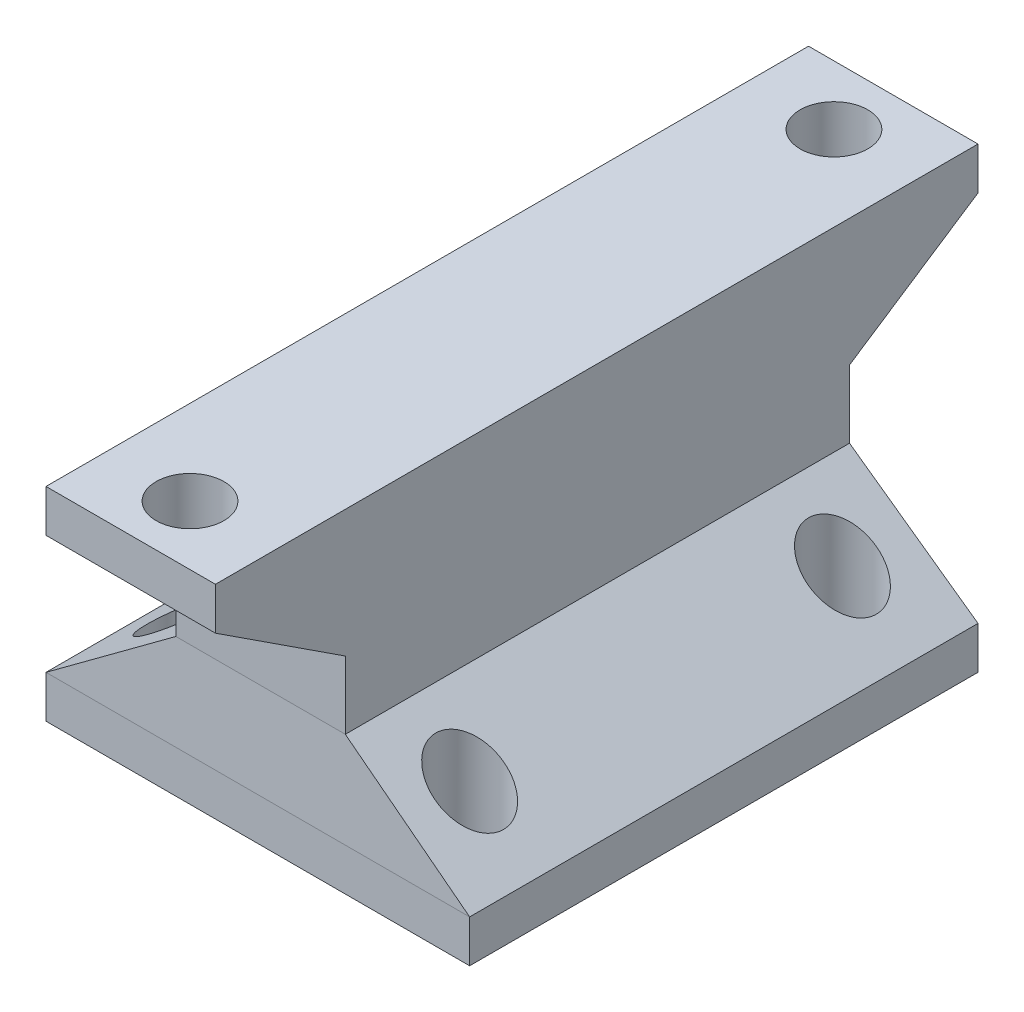
from build123d import *

# Parameters (mm, degrees)
SKETCH1_W               = 20
SKETCH1_H               = 90
BOSS_EXTRUDE1_DEPTH     = 5
BOSS_EXTRUDE2_DEPTH     = 20
SKETCH3_W               = 50
SKETCH3_H               = 60
BOSS_EXTRUDE3_DEPTH     = 5
SKETCH6_W               = 20
SKETCH6_H               = 59.508572424
BOSS_EXTRUDE4_DEPTH     = 8
CUT_EXTRUDE3_DEPTH      = 10
CUT_EXTRUDE3_DEPTH_BACK = 20
SKETCH5_R               = 4
CUT_EXTRUDE4_DEPTH      = 20
SKETCH7_R               = 5
CUT_EXTRUDE5_DEPTH      = 2


with BuildPart() as part:
    # Sketch1 → Boss-Extrude1 (new body)
    with BuildSketch(Plane(origin=(0, 0, 0), x_dir=(1, 0, 0), z_dir=(0, 1, 0))):
        Rectangle(SKETCH1_W, SKETCH1_H)
    extrude(amount=BOSS_EXTRUDE1_DEPTH)

    # Sketch2 → Boss-Extrude2 (add)
    with BuildSketch(Plane(origin=(10, 0, 0), x_dir=(0, 0, -1), z_dir=(1, 0, 0))):
        Polygon((-45, 0), (-29.672384363, -9.999664599), (0.081901849, -9.999664599), (0, 0), align=None)
        Polygon((0, 0), (0.081901849, -9.999664599), (29.836188061, -9.999664599), (45, 0), align=None)
    extrude(amount=-BOSS_EXTRUDE2_DEPTH)

    # Sketch6 → Boss-Extrude4 (add)
    with BuildSketch(Plane.XZ.offset(9.999664599)):
        with Locations((0, -0.081901849)):
            Rectangle(SKETCH6_W, SKETCH6_H)
    extrude(amount=BOSS_EXTRUDE4_DEPTH)


with BuildPart() as body_2:
    # Sketch3 → Boss-Extrude3 (new body)
    with BuildSketch(Plane(origin=(0, -28.999664599, 0), x_dir=(-1, 0, 0), z_dir=(0, -1, 0))):
        Rectangle(SKETCH3_W, SKETCH3_H)
    extrude(amount=BOSS_EXTRUDE3_DEPTH)


    add(part.part)  # loft3 joins it to this body
    # loft from a face of the part (loft3)
    loft([body_2.faces().sort_by_distance((0, -28.999664599, 0))[0], body_2.faces().sort_by_distance((0, -17.999664599, -0.081901849))[0]])

    # Sketch4 → Cut-Extrude3 (cut, two sides: drawn at the far end of the back side and taken through both)
    with BuildSketch(Plane.XZ.offset(33.999664599).offset(-CUT_EXTRUDE3_DEPTH_BACK)):
        with BuildLine():
            ThreePointArc((-13.080007345, 22), (-14.251580221, 24.828427125), (-17.080007345, 26))
            Line((-17.080007345, 26), (-17.080007345, 22))
            Line((-17.080007345, 22), (-21.080007345, 22))
            ThreePointArc((-21.080007345, 22), (-17.080007345, 18), (-13.080007345, 22))
        make_face()
        with BuildLine():
            Line((-17.080007345, 22), (-17.080007345, 26))
            ThreePointArc((-17.080007345, 26), (-19.90843447, 24.828427125), (-21.080007345, 22))
            Line((-21.080007345, 22), (-17.080007345, 22))
        make_face()
        with BuildLine():
            ThreePointArc((21, 22), (19.828427125, 24.828427125), (17, 26))
            Line((17, 26), (17, 22))
            Line((17, 22), (21, 22))
        make_face()
        with BuildLine():
            Line((17, 22), (17, 26))
            ThreePointArc((17, 26), (14.171572875, 19.171572875), (21, 22))
            Line((21, 22), (17, 22))
        make_face()
        with BuildLine():
            ThreePointArc((-21, -22), (-19.828427125, -24.828427125), (-17, -26))
            Line((-17, -26), (-17, -22))
            Line((-17, -22), (-21, -22))
        make_face()
        with BuildLine():
            Line((-17, -22), (-17, -26))
            ThreePointArc((-17, -26), (-14.171572875, -24.828427125), (-13, -22))
            ThreePointArc((-13, -22), (-17, -18), (-21, -22))
            Line((-21, -22), (-17, -22))
        make_face()
        with BuildLine():
            ThreePointArc((21, -22), (14.171572875, -19.171572875), (17, -26))
            Line((17, -26), (17, -22))
            Line((17, -22), (21, -22))
        make_face()
        with BuildLine():
            Line((17, -22), (17, -26))
            ThreePointArc((17, -26), (19.828427125, -24.828427125), (21, -22))
            Line((21, -22), (17, -22))
        make_face()
    extrude(amount=CUT_EXTRUDE3_DEPTH + CUT_EXTRUDE3_DEPTH_BACK, mode=Mode.SUBTRACT)

    # Sketch5 → Cut-Extrude4 (cut)
    with BuildSketch(Plane(origin=(0, 5, 0), x_dir=(1, 0, 0), z_dir=(0, 1, 0))):
        with Locations(Location((0, 38, 0), (0, 0, 270))):
            Circle(SKETCH5_R)
        with Locations(Location((0, -38, 0), (0, 0, 270))):
            Circle(SKETCH5_R)
    extrude(amount=-CUT_EXTRUDE4_DEPTH, mode=Mode.SUBTRACT)

    # Sketch7 → Cut-Extrude5 (cut)
    with BuildSketch(Plane.XZ.offset(33.999664599)):
        with Locations(Location((0, 0, 0), (0, 0, 270))):
            Circle(SKETCH7_R)
    extrude(amount=-CUT_EXTRUDE5_DEPTH, mode=Mode.SUBTRACT)


solid = body_2.part
